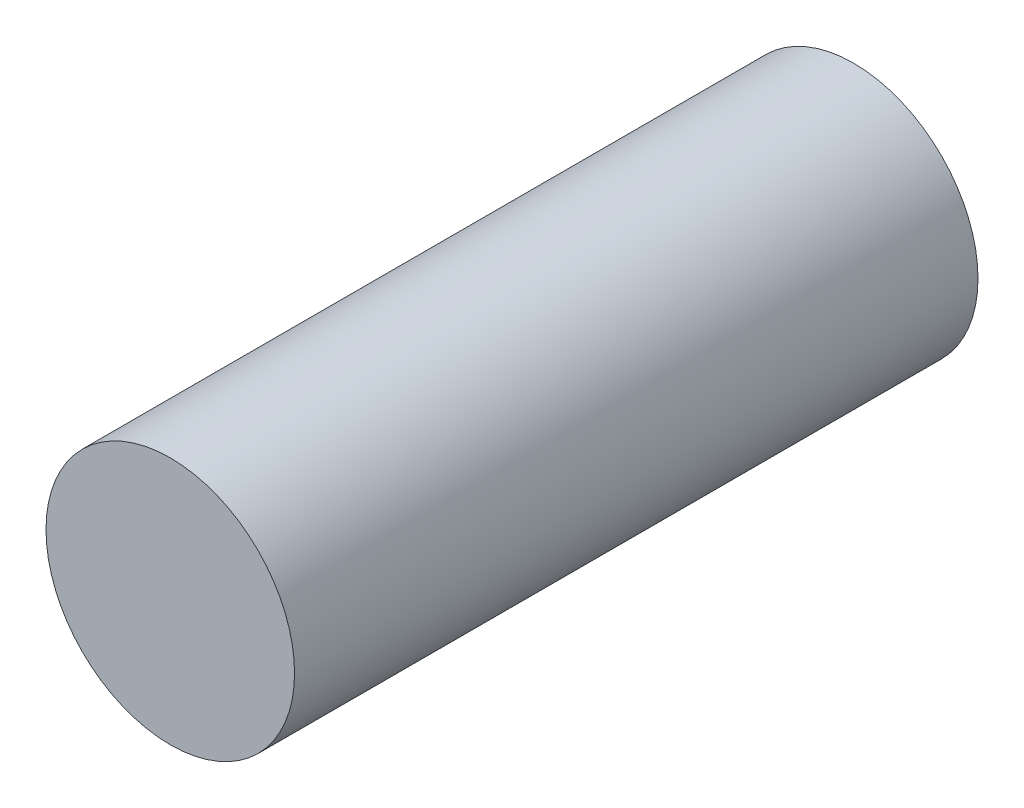
from build123d import *

# Parameters (mm, degrees)
SKETCH1_R           = 10
BOSS_EXTRUDE1_DEPTH = 55


with BuildPart() as part:
    # Sketch1 → Boss-Extrude1 (new body)
    with BuildSketch(Plane.XY):
        Circle(SKETCH1_R)
    extrude(amount=BOSS_EXTRUDE1_DEPTH)


solid = part.part
